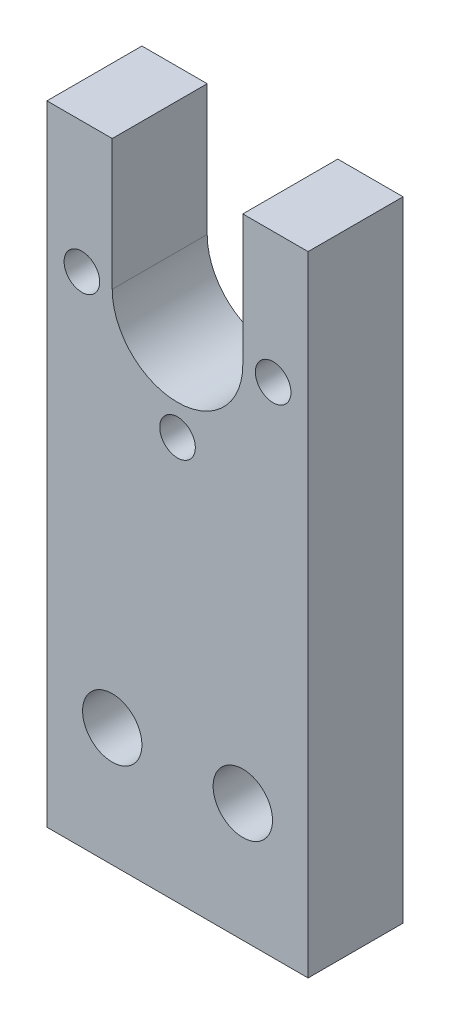
from build123d import *

# Parameters (mm, degrees)
SKETCH_1_W          = 22
SKETCH_1_H          = 53
SKETCH_1_R          = 2.5
SKETCH_1_R_2        = 5.5
SKETCH_1_R_3        = 1.5
EXTRUDE_1_DEPTH     = 8
CUT_EXTRUDE_START   = -10
CUT_EXTRUDE_1_DEPTH = 10


with BuildPart() as part:
    # 草图1 → 凸台-拉伸1 (new body)
    with BuildSketch(Plane.XY):
        with Locations((-7.008849558, -2.699115044)):
            Rectangle(SKETCH_1_W, SKETCH_1_H)
        with Locations((-12.508849558, -19.199115044)):
            Circle(SKETCH_1_R, mode=Mode.SUBTRACT)
        with Locations((-1.508849558, -19.199115044)):
            Circle(SKETCH_1_R, mode=Mode.SUBTRACT)
        with Locations((-7.008849558, 12.800884956)):
            Circle(SKETCH_1_R_2, mode=Mode.SUBTRACT)
        with Locations((-7.008849558, 20.858941567)):
            Circle(SKETCH_1_R_3, mode=Mode.SUBTRACT)
        with Locations((1.049207054, 12.800884956)):
            Circle(SKETCH_1_R_3, mode=Mode.SUBTRACT)
        with Locations((-7.008849558, 4.742828344)):
            Circle(SKETCH_1_R_3, mode=Mode.SUBTRACT)
        with Locations((-15.066906169, 12.800884956)):
            Circle(SKETCH_1_R_3, mode=Mode.SUBTRACT)
    extrude(amount=EXTRUDE_1_DEPTH)

    # 草图2 → 切除-拉伸1 (cut)
    with BuildSketch(Plane.XY.offset(8).offset(CUT_EXTRUDE_START)):
        with BuildLine():
            Line((-12.508849558, 12.800884956), (-12.508849558, 23.800884956))
            Line((-12.508849558, 23.800884956), (-1.508849558, 23.800884956))
            Line((-1.508849558, 23.800884956), (-1.508849558, 12.800884956))
            ThreePointArc((-1.508849558, 12.800884956), (-7.008849558, 7.300884956), (-12.508849558, 12.800884956))
        make_face()
    extrude(amount=CUT_EXTRUDE_1_DEPTH, mode=Mode.SUBTRACT)


solid = part.part
